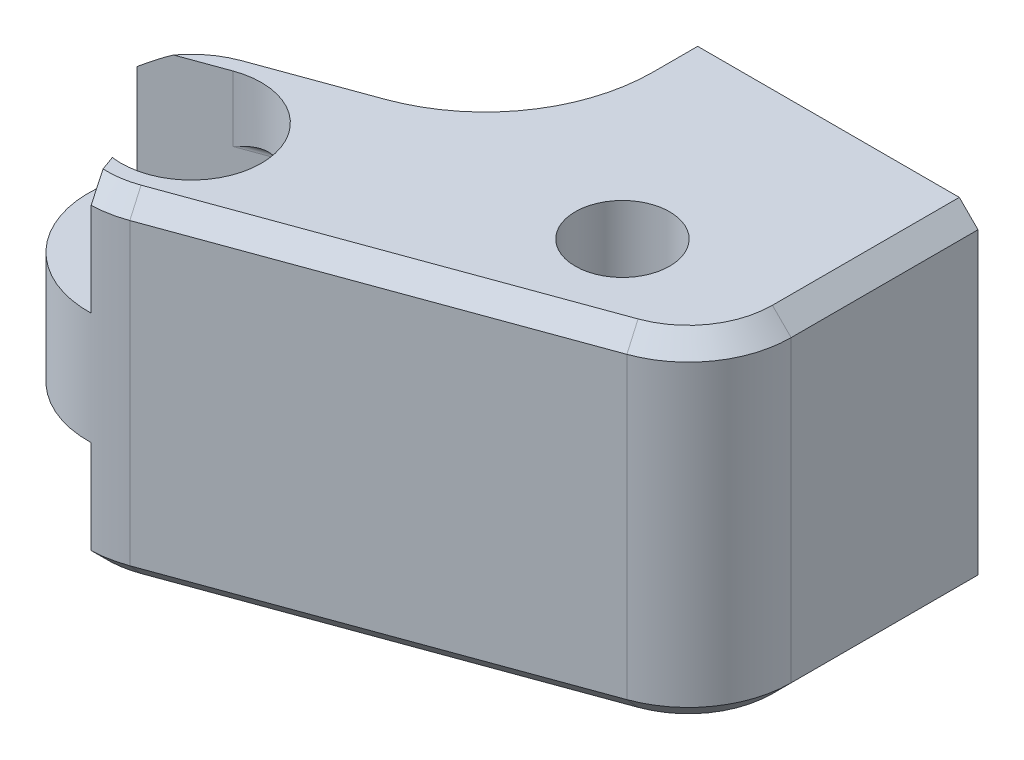
from build123d import *

# Parameters (mm, degrees)
EXTRUDE_1_DEPTH     = 14.999999999999998
CUT_EXTRUDE_1_DEPTH = 32.759958749611776
CUT_EXTRUDE_2_DEPTH = 5.999999999999998
CUT_EXTRUDE_START   = -2.9999999999999996
CUT_EXTRUDE_3_DEPTH = 2.9999999999999996
CUT_EXTRUDE_START_2 = -3.0000000000000004
CUT_EXTRUDE_4_DEPTH = 3.0000000000000004
CUT_EXTRUDE_5_DEPTH = 10.50007039461797
CUT_EXTRUDE_6_DEPTH = 11.327672160759418
EXTRUDE_2_DEPTH     = 7.968709711177614
EXTRUDE_3_DEPTH     = 3.000000000000002
HOLE_WIZARD_1_D     = 4.2
HOLE_WIZARD_1_DEPTH = 7
HOLE_WIZARD_2_D     = 2.03
HOLE_WIZARD_2_DEPTH = 4
HOLE_WIZARD_3_D     = 2.03
HOLE_WIZARD_3_DEPTH = 4
HOLE_WIZARD_4_D     = 5.05
HOLE_WIZARD_5_D     = 5.02
HOLE_WIZARD_5_DEPTH = 12
FILLET_1_R          = 5.500000000000002
FILLET_2_R          = 8
CHAMFER_1_SIZE      = 0.9999999999999993
FILLET_3_R          = 0.5


with BuildPart() as part:
    # 草图1 → 凸台-拉伸1 (new body)
    with BuildSketch(Plane(origin=(0, 18, 0), x_dir=(1, 0, 0), z_dir=(0, 1, 0))):
        with BuildLine():
            Line((-17.618889211708797, -12.26572898251346), (21.661848401793918, 2.0312902888225244))
            Line((21.661848401793918, 2.0312902888225244), (-10.5, 2.0312902888223876))
            Line((-10.5, 2.0312902888223876), (-21.381110788291235, -1.9291101538684705))
            ThreePointArc((-21.381110788291235, -1.9291101538684705), (-24.668309414322497, -8.978530356482176), (-17.618889211708797, -12.26572898251346))
        make_face()
    extrude(amount=-EXTRUDE_1_DEPTH)

    # 草图2 → 切除-拉伸1 (cut, through all)
    with BuildSketch(Plane(origin=(0, 18, 0), x_dir=(-1, 0, 0), z_dir=(0, 1, 0))):
        Polygon((-21.66184840179392, -2.0312902888223894), (-5.5000000000000036, -2.0312902888223876), (-5.500000000000005, 3.8511414601534057), align=None)
    extrude(amount=-CUT_EXTRUDE_1_DEPTH, mode=Mode.SUBTRACT)

    # 草图3 → 切除-拉伸2 (cut)
    with BuildSketch(Plane(origin=(0, 18, 0), x_dir=(-1, 0, 0), z_dir=(0, 1, 0))):
        with BuildLine():
            Line((20.78257553747125, 3.5735722402438013), (24.563305918164147, 4.949645562601932))
            ThreePointArc((24.563305918164147, 4.949645562601932), (24.047293898775088, 10.191303567012326), (19.3611131717343, 12.59566569299606))
            Line((19.3611131717343, 12.59566569299606), (20.01010960022055, 10.812562660423456))
            ThreePointArc((20.01010960022055, 10.812562660423456), (15.771169677152303, 6.6995195513380725), (20.78257553747125, 3.5735722402438013))
        make_face()
    extrude(amount=-CUT_EXTRUDE_2_DEPTH, mode=Mode.SUBTRACT)

    # 草图4 → 切除-拉伸3 (cut)
    with BuildSketch(Plane.XZ.offset(-12).offset(CUT_EXTRUDE_START)):
        with BuildLine():
            Line((-20.78257553747125, 3.573572240243805), (-18.036485631419698, 2.5740772538221752))
            Line((-18.036485631419698, 2.5740772538221752), (-17.557657430763733, 3.889646922922488))
            ThreePointArc((-17.557657430763733, 3.889646922922488), (-19.134214632183554, 3.365302064053206), (-20.78257553747125, 3.573572240243805))
        make_face()
    extrude(amount=CUT_EXTRUDE_3_DEPTH, mode=Mode.SUBTRACT)

    # 草图5 → 切除-拉伸4 (cut)
    with BuildSketch(Plane.XZ.offset(-3.000000000000001).offset(CUT_EXTRUDE_START_2)):
        with BuildLine():
            Line((-17.258794358827192, 2.29102077914986), (-16.779966158171227, 3.606590448250214))
            Line((-16.779966158171227, 3.606590448250214), (-17.557657430763737, 3.8896469229224904))
            ThreePointArc((-17.557657430763737, 3.8896469229224904), (-15.965242102135065, 8.349612286378331), (-20.01010960022055, 10.81256266042346))
            Line((-20.01010960022055, 10.81256266042346), (-19.3611131717343, 12.59566569299606))
            ThreePointArc((-19.3611131717343, 12.59566569299606), (-24.04729389877508, 10.191303567012337), (-24.56330591816415, 4.94964556260195))
            Line((-24.56330591816415, 4.94964556260195), (-17.258794358827192, 2.29102077914986))
        make_face()
    extrude(amount=CUT_EXTRUDE_4_DEPTH, mode=Mode.SUBTRACT)

    # 草图6 → 切除-拉伸5 (cut)
    with BuildSketch(Plane(origin=(-15.97621882135595, 0, 5.8148681070970145), x_dir=(0.3420201433256677, 0, 0.9396926207859088), z_dir=(-0.9396926207859089, 0, 0.3420201433256677))):
        Polygon((-2.3499999999999055, 3), (-2.349999999999906, 6), (-3.7499999999999933, 6), (-3.749999999999994, 3), align=None)
    extrude(amount=-CUT_EXTRUDE_5_DEPTH, mode=Mode.SUBTRACT)

    # 草图7 → 切除-拉伸6 (cut)
    with BuildSketch(Plane(origin=(-16.753910093948367, 0, 6.097924581769449), x_dir=(0.3420201433256676, 0, 0.9396926207859088), z_dir=(-0.9396926207859088, 0, 0.3420201433256676))):
        Polygon((-3.749999999999993, 12), (-2.3499999999999055, 12), (-2.3499999999999055, 15), (-3.7499999999999933, 15), align=None)
    extrude(amount=-CUT_EXTRUDE_6_DEPTH, mode=Mode.SUBTRACT)

    # 草图8 → 凸台-拉伸2 (add)
    with BuildSketch(Plane(origin=(-8.63e-15, 0, -2.0312902888224325), x_dir=(-1, 0, 5e-17), z_dir=(-5e-17, 0, -1))):
        Polygon((-5.5, 3), (-5.500000000000001, 18), (10.5, 18), (10.5, 3), align=None)
    extrude(amount=EXTRUDE_2_DEPTH)

    # 草图9 → 凸台-拉伸3 (add)
    with BuildSketch(Plane.XZ.offset(-3.000000000000001)):
        with BuildLine():
            Line((-17.618889211708797, 12.26572898251346), (5.499999999999998, 3.8511414601533294))
            Line((5.499999999999998, 3.8511414601533294), (5.5, -10))
            Line((5.5, -10), (-10.5, -10.000000000000002))
            Line((-10.5, -10.000000000000002), (-10.500000000000014, -2.0312902888224262))
            Line((-10.500000000000014, -2.0312902888224262), (-21.381110788291203, 1.9291101538684652))
            ThreePointArc((-21.381110788291203, 1.9291101538684652), (-23.286441520356178, 3.1083268627098155), (-24.563305918164144, 4.94964556260193))
            Line((-24.563305918164144, 4.94964556260193), (-20.78257553747125, 3.573572240243805))
            ThreePointArc((-20.78257553747125, 3.573572240243805), (-15.771169677152304, 6.699519551338072), (-20.01010960022055, 10.81256266042346))
            Line((-20.01010960022055, 10.81256266042346), (-19.361113171734285, 12.595665692996059))
            ThreePointArc((-19.361113171734285, 12.595665692996059), (-18.476617299855562, 12.50137070130135), (-17.618889211708797, 12.26572898251346))
        make_face()
    extrude(amount=EXTRUDE_3_DEPTH)

    # 孔1
    with Locations(Plane(origin=(-5.4e-16, 0, -10.000000000000046), x_dir=(-1, 0, 5e-17), z_dir=(-5e-17, 0, -1))):
        with Locations((4.5, 9)):
            Hole(HOLE_WIZARD_1_D / 2, depth=HOLE_WIZARD_1_DEPTH)

    # 孔2
    with Locations(Plane(origin=(-5.4e-16, 0, -10.000000000000046), x_dir=(-1, 0, 5e-17), z_dir=(-5e-17, 0, -1))):
        with Locations((-0.5, 13)):
            Hole(HOLE_WIZARD_2_D / 2, depth=HOLE_WIZARD_2_DEPTH)

    # 孔3
    with Locations(Plane(origin=(-5.4e-16, 0, -10.000000000000046), x_dir=(-1, 0, 5e-17), z_dir=(-5e-17, 0, -1))):
        with Locations((-0.5, 5)):
            Hole(HOLE_WIZARD_3_D / 2, depth=HOLE_WIZARD_3_DEPTH)

    # 孔4 (through all)
    with Locations(Plane(origin=(0, 18, 0), x_dir=(1, 0, 0), z_dir=(0, 1, 0))):
        with Locations((-2.585532826, -0.941056988)):
            Hole(HOLE_WIZARD_4_D / 2)

    # 孔5
    with Locations(Plane(origin=(0, 12, 0), x_dir=(1, 0, 0), z_dir=(0, 1, 0))):
        with Locations((-19.5, -7.097419568)):
            Hole(HOLE_WIZARD_5_D / 2, depth=HOLE_WIZARD_5_DEPTH)

    # 圆角1
    fillet_1_edges = [part.edges().sort_by_distance(p)[0] for p in [
        (5.500000000000002, 8.999999999999998, 3.8511414601533676),
    ]]
    fillet(fillet_1_edges, radius=FILLET_1_R)

    # 圆角2
    fillet_2_edges = [part.edges().sort_by_distance(p)[0] for p in [
        (-10.50000000000001, 9, -2.031290288822418),
    ]]
    fillet(fillet_2_edges, radius=FILLET_2_R)

    # 倒角1
    chamfer_1_edges = [part.edges().sort_by_distance(p)[0] for p in [
        (-18.47661729985556, -1.33e-15, 12.50137070130135),
        (-23.286441520356178, -1.33e-15, 3.108326862709817),
        (-18.572474820842935, -1.33e-15, 0.9068502628278257),
        (5.499999999999999, -1.33e-15, -5.000000000000032),
        (-7.868889211708797, -1.33e-15, 8.717019198417944),
        (4.505336243589472, 17.999999999999986, 3.15467039993076),
        (4.505336243589466, -1.65e-14, 3.154670399930683),
        (-10.500000000000002, -1.33e-15, -8.816475297250042),
        (-18.57247482084295, 18, 0.9068502628278368),
        (-11.946783645688074, 17.999999999999993, -3.044339103691696),
        (-11.946783645688082, -7.42e-15, -3.0443391036917093),
        (5.4999999999999964, 18, -5.000000000000016),
        (-18.476617299855565, 18, 12.501370701301362),
        (-7.868889211708806, 18, 8.717019198417947),
        (-23.286441520356195, 18, 3.1083268627098226),
        (-10.500000000000009, 18, -8.816475297250054),
    ]]
    chamfer(chamfer_1_edges, length=CHAMFER_1_SIZE)

    # 圆角3
    fillet_3_edges = [part.edges().sort_by_distance(p)[0] for p in [
        (-14.087265614371681, 3.0000000000000004, 1.1366787190484136),
        (-14.087265614371635, 15, 1.1366787190484962),
        (-15.977630804718132, 6.000000000000001, 1.8247153802274876),
        (-12.23539246068994, 6.000000000000001, 1.9525008949379346),
        (-12.23539246068994, 3.0000000000000004, 1.9525008949379348),
        (-12.235392460689857, 15, 1.952500894938097),
        (-12.235392460689857, 12, 1.952500894938097),
    ]]
    fillet(fillet_3_edges, radius=FILLET_3_R)


solid = part.part
